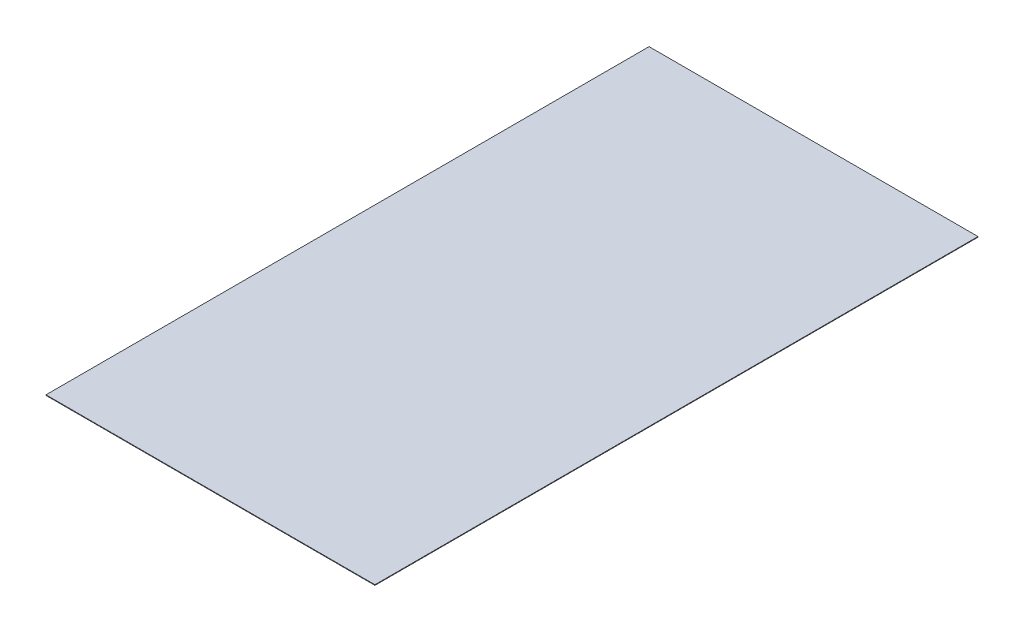
from build123d import *

# Parameters (mm, degrees)
SKETCH1_W           = 3657.6
SKETCH1_H           = 6705.6
BOSS_EXTRUDE1_DEPTH = 6.35


with BuildPart() as part:
    # Sketch1 → Boss-Extrude1 (new body)
    with BuildSketch(Plane(origin=(0, 0, 0), x_dir=(1, 0, 0), z_dir=(0, 1, 0))):
        Rectangle(SKETCH1_W, SKETCH1_H)
    extrude(amount=BOSS_EXTRUDE1_DEPTH)


solid = part.part
